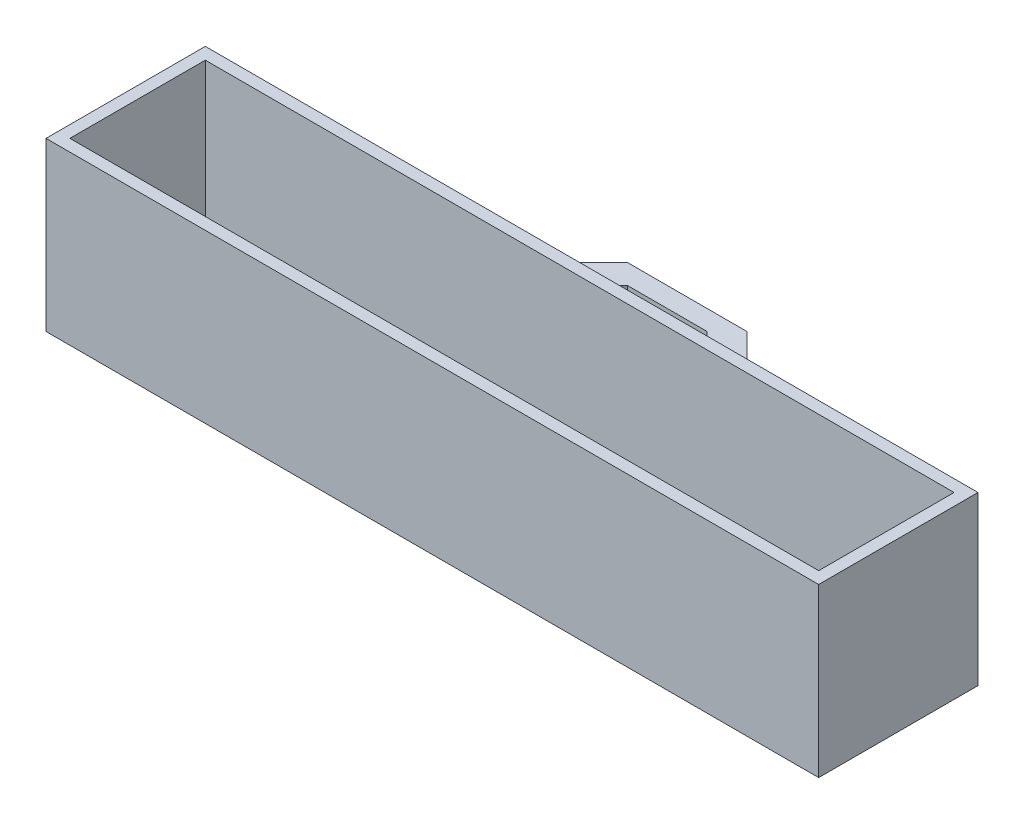
from build123d import *

# Parameters (mm, degrees)
SKETCH_1_W          = 970
SKETCH_1_H          = 200
SKETCH_1_W_2        = 940
SKETCH_1_H_2        = 170
EXTRUDE_1_DEPTH     = 200
SKETCH_2_W          = 970
SKETCH_2_H          = 200
EXTRUDE_2_DEPTH     = 10
SKETCH_3_W          = 250
SKETCH_3_H          = 30
EXTRUDE_3_DEPTH     = 120
SKETCH_4_W          = 200
SKETCH_4_H          = 95
CUT_EXTRUDE_1_DEPTH = 120
CHAMFER_1_SIZE      = 10
CHAMFER_2_SIZE      = 50


with BuildPart() as part:
    # 草图1 → 凸台-拉伸1 (new body)
    with BuildSketch(Plane(origin=(0, 0, 0), x_dir=(1, 0, 0), z_dir=(0, 1, 0))):
        Rectangle(SKETCH_1_W, SKETCH_1_H)
        Rectangle(SKETCH_1_W_2, SKETCH_1_H_2, mode=Mode.SUBTRACT)
    extrude(amount=EXTRUDE_1_DEPTH)

    # 草图2 → 凸台-拉伸2 (add)
    with BuildSketch(Plane.XZ):
        Rectangle(SKETCH_2_W, SKETCH_2_H)
    extrude(amount=EXTRUDE_2_DEPTH)

    # 草图3 → 凸台-拉伸3 (add)
    with BuildSketch(Plane(origin=(0, 0, -100), x_dir=(-1, 0, 0), z_dir=(0, 0, -1))):
        with Locations((0, 95)):
            Rectangle(SKETCH_3_W, SKETCH_3_H)
    extrude(amount=EXTRUDE_3_DEPTH)

    # 草图4 → 切除-拉伸1 (cut)
    with BuildSketch(Plane(origin=(0, 110, 0), x_dir=(1, 0, 0), z_dir=(0, 1, 0))):
        with Locations((0, 147.5)):
            Rectangle(SKETCH_4_W, SKETCH_4_H)
    extrude(amount=-CUT_EXTRUDE_1_DEPTH, mode=Mode.SUBTRACT)

    # 倒角1
    chamfer_1_edges = [part.edges().sort_by_distance(p)[0] for p in [
        (-125, 95, -100),
        (-112.5, 110, -100),
        (125, 95, -100),
        (112.5, 80, -100),
        (-112.5, 80, -100),
        (112.5, 110, -100),
        (-100, 95, -100),
        (100, 95, -100),
    ]]
    chamfer(chamfer_1_edges, length=CHAMFER_1_SIZE)

    # 倒角2
    chamfer_2_edges = [part.edges().sort_by_distance(p)[0] for p in [
        (-125, 95, -220),
        (125, 95, -220),
        (-100, 95, -195),
        (100, 95, -195),
    ]]
    chamfer(chamfer_2_edges, length=CHAMFER_2_SIZE)


solid = part.part
